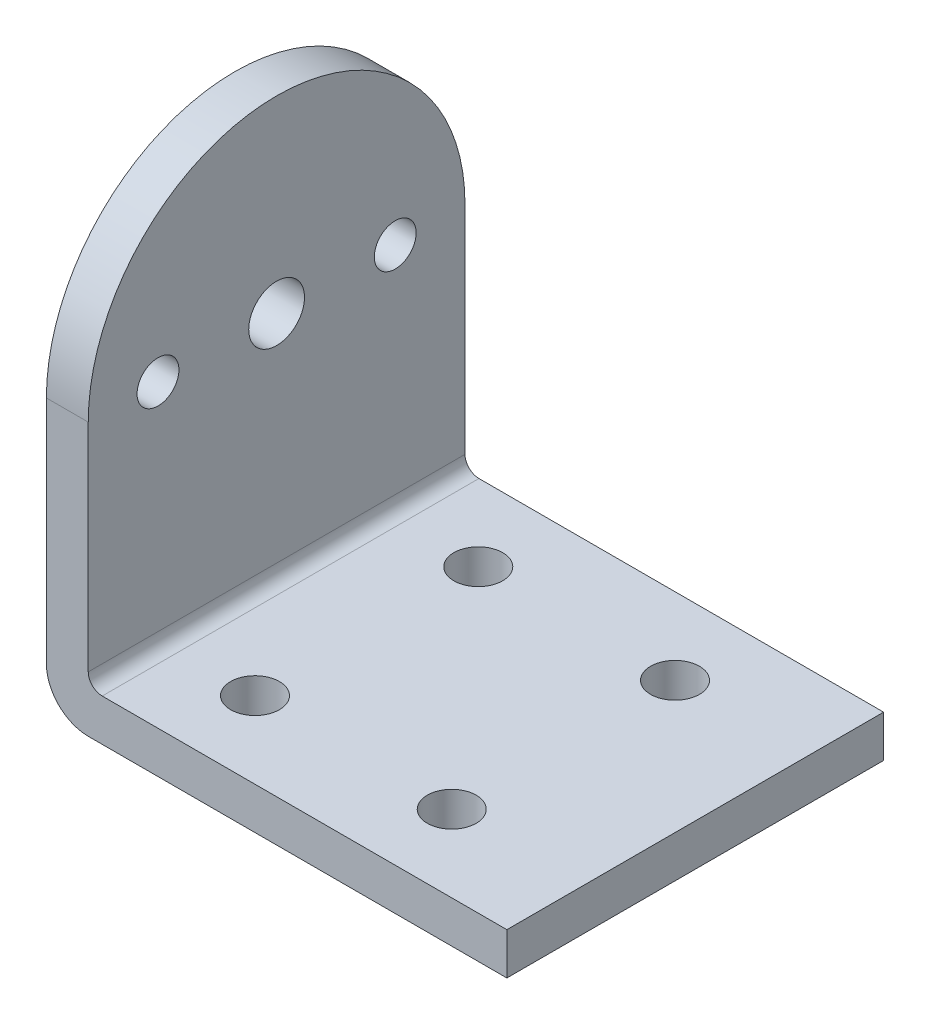
from build123d import *

# Parameters (mm, degrees)
P_IDAT_VYSUNUT_M1_DEPTH  = 27
ZAOBLIT1_R               = 1
SKICA2_R                 = 1.75
ODEBRAT_VYSUNUT_M1_DEPTH = 3
ZAOBLIT2_R               = 3
ODEBRAT_VYSUNUT_M2_DEPTH = 3
SKICA3_3_R               = 1.5
ODEBRAT_VYSUNUT_M3_DEPTH = 3
SKICA3_4_R               = 2
ODEBRAT_VYSUNUT_M4_DEPTH = 3


with BuildPart() as part:
    # Skica1 → Přidat vysunutím1 (new body)
    with BuildSketch(Plane.XY):
        Polygon((0, 0), (0, 33), (3, 33), (3, 3), (33, 3), (33, 0), align=None)
    extrude(amount=P_IDAT_VYSUNUT_M1_DEPTH)

    # Zaoblit1
    zaoblit1_edges = [part.edges().sort_by_distance(p)[0] for p in [
        (3, 3, 13.5),
    ]]
    fillet(zaoblit1_edges, radius=ZAOBLIT1_R)

    # Skica2 → Odebrat vysunutím1 (cut)
    with BuildSketch(Plane.XZ):
        with Locations((9.45, 21.5)):
            Circle(SKICA2_R)
        with Locations((23.55, 21.5)):
            Circle(SKICA2_R)
        with Locations((23.55, 5.5)):
            Circle(SKICA2_R)
        with Locations((9.45, 5.5)):
            Circle(SKICA2_R)
    extrude(amount=-ODEBRAT_VYSUNUT_M1_DEPTH, mode=Mode.SUBTRACT)

    # Zaoblit2
    zaoblit2_edges = [part.edges().sort_by_distance(p)[0] for p in [
        (0, 0, 13.5),
    ]]
    fillet(zaoblit2_edges, radius=ZAOBLIT2_R)

    # Skica3 → Odebrat vysunutím2 (cut)
    with BuildSketch(Plane.ZY):
        with BuildLine():
            Line((27, 33), (13.5, 33))
            ThreePointArc((13.5, 33), (23.045941546, 29.045941546), (27, 19.5))
            Line((27, 19.5), (27, 33))
        make_face()
        with BuildLine():
            Line((0, 33), (0, 19.5))
            ThreePointArc((0, 19.5), (3.954058454, 29.045941546), (13.5, 33))
            Line((13.5, 33), (0, 33))
        make_face()
    extrude(amount=-ODEBRAT_VYSUNUT_M2_DEPTH, mode=Mode.SUBTRACT)

    # Skica3<3> → Odebrat vysunutím3 (cut)
    with BuildSketch(Plane.ZY):
        with Locations((5, 19.5)):
            Circle(SKICA3_3_R)
        with Locations((22, 19.5)):
            Circle(SKICA3_3_R)
    extrude(amount=-ODEBRAT_VYSUNUT_M3_DEPTH, mode=Mode.SUBTRACT)

    # Skica3<4> → Odebrat vysunutím4 (cut)
    with BuildSketch(Plane.ZY):
        with Locations((13.5, 19.5)):
            Circle(SKICA3_4_R)
    extrude(amount=-ODEBRAT_VYSUNUT_M4_DEPTH, mode=Mode.SUBTRACT)


solid = part.part
